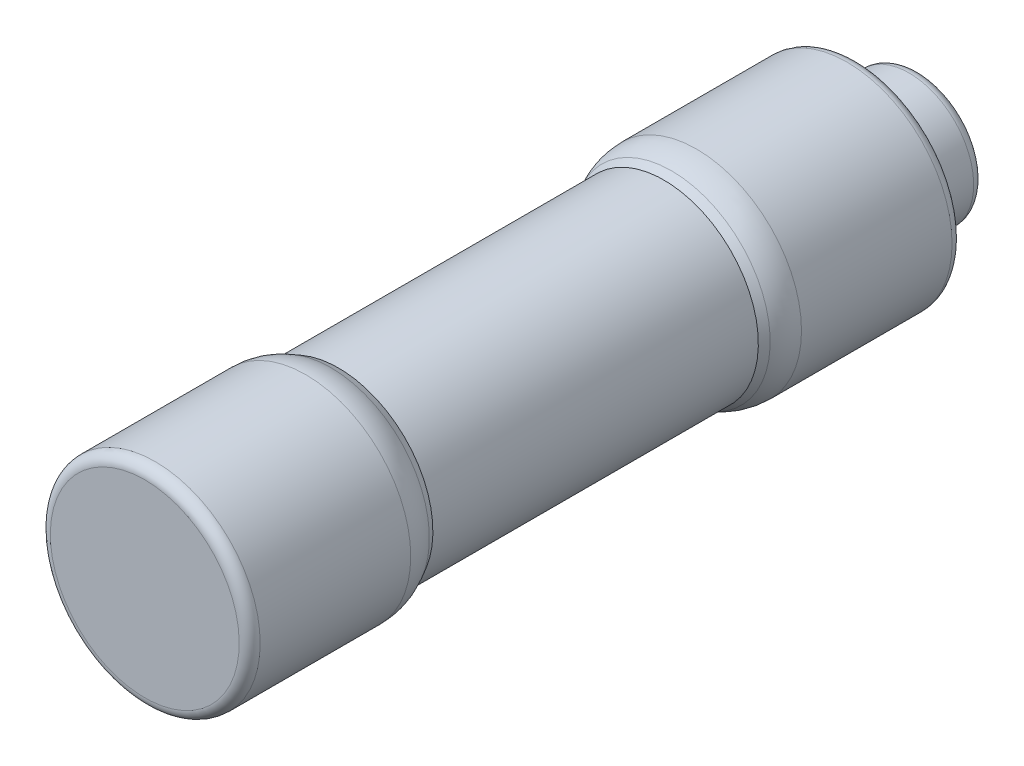
from build123d import *

# Parameters (mm, degrees)
FILLET2_R              = 2.5796875
FILLET1_R              = 0.5159375
SPLIT1_SURFACE_1_BACK  = 41.799
SPLIT1_SURFACE_1_DEPTH = 83.598
SPLIT1_SURFACE_2_BACK  = 41.799
SPLIT1_SURFACE_2_DEPTH = 83.598


with BuildPart() as part:
    # Sketch2 → Revolve1 (revolve)
    with BuildSketch(Plane(origin=(0, 0, 0), x_dir=(0, 0, -1), z_dir=(1, 0, 0)), mode=Mode.PRIVATE) as revolve1_sk:
        Polygon((-19.05, 5.159375), (-19.05, 0), (19.05, 0), (19.05, 3.175), (16.002, 3.175), (16.002, 5.159375), (7.4295, 5.159375), (6.477, 4.6434375), (-9.525, 4.6434375), (-10.4775, 5.159375), align=None)
    revolve(revolve1_sk.sketch.rotate(Axis((0, 0, 19.05), (0, 0, -1)), 180), axis=Axis((0, 0, 19.05), (0, 0, -1)))

    # Fillet2
    fillet2_edges = [part.edges().sort_by_distance(p)[0] for p in [
        (0, 5.159375, 10.4775),
        (0, 5.159375, -7.4295),
    ]]
    fillet(fillet2_edges, radius=FILLET2_R)

    # Fillet1
    fillet1_edges = [part.edges().sort_by_distance(p)[0] for p in [
        (0, 5.159375, 19.05),
        (0, 5.159375, -16.002),
        (0, 3.175, -16.002),
        (0, 3.175, -19.05),
    ]]
    fillet(fillet1_edges, radius=FILLET1_R)


with BuildPart() as body_2:
    # Split1: the piece behind the surface
    add(part.part)
    # Split1 surface: a surface, the sketch's curves swept straight by 83.598 mm
    with BuildLine(Plane(origin=(0, 0, 0), x_dir=(0, 0, -1), z_dir=(1, 0, 0)).offset(-SPLIT1_SURFACE_1_BACK), mode=Mode.PRIVATE) as split1_surface_1_path:
        Line((-9.525, 4.6434375), (-9.525, -4.6434375))
        Line((-9.525, -4.6434375), (6.477, -4.6434375))
        Line((6.477, -4.6434375), (6.477, 4.6434375))
    split1_surface_1 = Shell.extrude(split1_surface_1_path.wire(), (1 * SPLIT1_SURFACE_1_DEPTH, 0 * SPLIT1_SURFACE_1_DEPTH, 0 * SPLIT1_SURFACE_1_DEPTH))
    split(bisect_by=split1_surface_1, keep=Keep.BOTTOM)


with BuildPart() as part_1:
    add(part.part)

    # Split1: split by a surface, the side it looks to stays
    # Split1 surface: a surface, the sketch's curves swept straight by 83.598 mm
    with BuildLine(Plane(origin=(0, 0, 0), x_dir=(0, 0, -1), z_dir=(1, 0, 0)).offset(-SPLIT1_SURFACE_2_BACK), mode=Mode.PRIVATE) as split1_surface_2_path:
        Line((-9.525, 4.6434375), (-9.525, -4.6434375))
        Line((-9.525, -4.6434375), (6.477, -4.6434375))
        Line((6.477, -4.6434375), (6.477, 4.6434375))
    split1_surface_2 = Shell.extrude(split1_surface_2_path.wire(), (1 * SPLIT1_SURFACE_2_DEPTH, 0 * SPLIT1_SURFACE_2_DEPTH, 0 * SPLIT1_SURFACE_2_DEPTH))
    split(bisect_by=split1_surface_2, keep=Keep.TOP)


solid = Compound([body_2.part, part_1.part])
